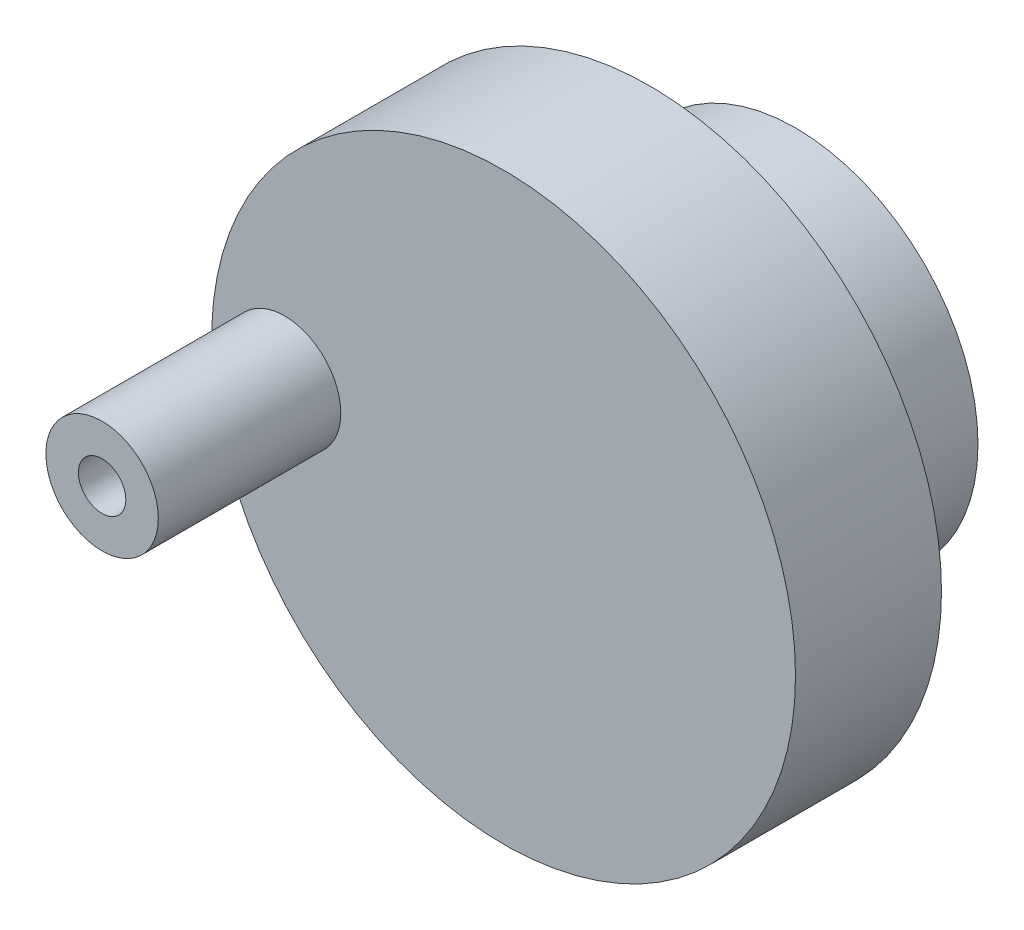
from build123d import *

# Parameters (mm, degrees)
SKETCH1_R           = 20
BOSS_EXTRUDE1_DEPTH = 10
SKETCH2_R           = 3.85
BOSS_EXTRUDE2_DEPTH = 12.5
SKETCH3_R           = 12.5
BOSS_EXTRUDE3_DEPTH = 10
SKETCH5_R           = 1.5
CUT_EXTRUDE1_DEPTH  = 16.5
SKETCH6_R           = 1.625
CUT_EXTRUDE2_DEPTH  = 5.2
FILLET1_R           = 5


with BuildPart() as part:
    # Sketch1 → Boss-Extrude1 (new body)
    with BuildSketch(Plane.XY):
        Circle(SKETCH1_R)
    extrude(amount=BOSS_EXTRUDE1_DEPTH)

    # Sketch2 → Boss-Extrude2 (add)
    with BuildSketch(Plane.XY.offset(10)):
        with Locations((-15, 0)):
            Circle(SKETCH2_R)
    extrude(amount=BOSS_EXTRUDE2_DEPTH)

    # Sketch3 → Boss-Extrude3 (add)
    with BuildSketch(Plane(origin=(0, 0, 0), x_dir=(-1, 0, 0), z_dir=(0, 0, -1))):
        with Locations(Location((0, 0, 0), (0, 0, 180))):
            Circle(SKETCH3_R)
        Polygon((3.464101615, 6), (-3.464101615, 6), (-6.92820323, 0), (-3.464101615, -6), (3.464101615, -6), (6.92820323, 0), align=None, mode=Mode.SUBTRACT)
    extrude(amount=BOSS_EXTRUDE3_DEPTH)

    # Sketch5 → Cut-Extrude1 (cut)
    with BuildSketch(Plane.XY.offset(22.5)):
        with Locations((-15, 0)):
            Circle(SKETCH5_R)
    extrude(amount=-CUT_EXTRUDE1_DEPTH, mode=Mode.SUBTRACT)

    # Sketch6 → Cut-Extrude2 (cut)
    with BuildSketch(Plane.XY.offset(22.5)):
        with Locations((-15, 0)):
            Circle(SKETCH6_R)
    extrude(amount=-CUT_EXTRUDE2_DEPTH, mode=Mode.SUBTRACT)

    # Fillet1
    fillet1_edges = [part.edges().sort_by_distance(p)[0] for p in [
        (-12.5, 0, 0),
    ]]
    fillet(fillet1_edges, radius=FILLET1_R)


solid = part.part
